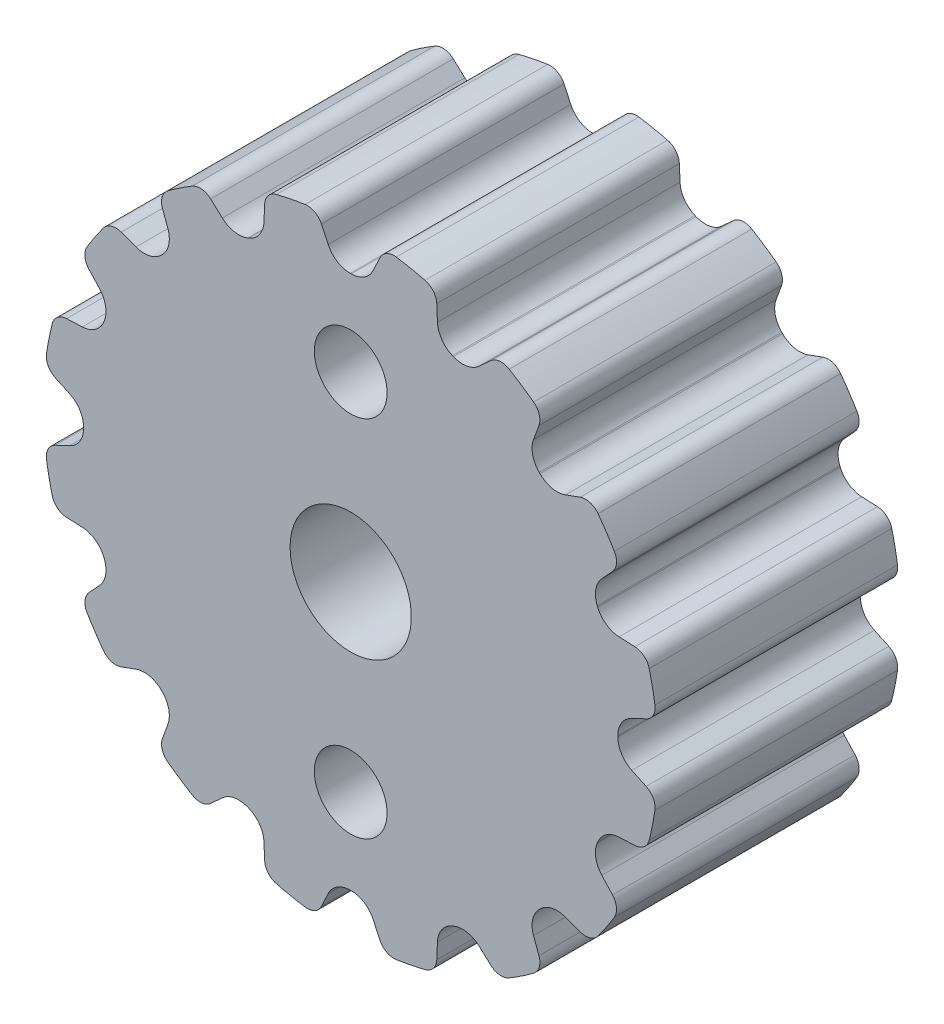
from build123d import *

# Parameters (mm, degrees)
EXTRUDE_2_DEPTH     = 10
SKETCH_2_R          = 1.5
SKETCH_2_R_2        = 2.5
CUT_EXTRUDE_1_DEPTH = 10


with BuildPart() as part:
    # Эскиз1 → Бобышка-Вытянуть2 (new body)
    with BuildSketch(Plane.XY):
        with BuildLine():
            Line((-31.362440493, 3.510393804), (-31.316510754, 3.510393804))
            ThreePointArc((-31.316510754, 3.510393804), (-30.779211146, 3.667002358), (-30.410202967, 4.087775542))
            Line((-30.410202967, 4.087775542), (-30.135127286, 4.677677244))
            ThreePointArc((-30.135127286, 4.677677244), (-29.857903031, 4.971031718), (-29.460241123, 5.040134122))
            ThreePointArc((-29.460241123, 5.040134122), (-28.86569521, 4.936515013), (-28.276753094, 4.804723716))
            ThreePointArc((-28.276753094, 4.804723716), (-27.935805741, 4.588702796), (-27.791945823, 4.211589471))
            Line((-27.791945823, 4.211589471), (-27.763554639, 3.561324458))
            ThreePointArc((-27.763554639, 3.561324458), (-27.583658462, 3.031367409), (-27.14718985, 2.681064313))
            Line((-27.14718985, 2.681064313), (-27.104821217, 2.66351465))
            ThreePointArc((-27.104821217, 2.66351465), (-26.548489607, 2.60258643), (-26.046547577, 2.850116846))
            Line((-26.046547577, 2.850116846), (-25.566665178, 3.289848048))
            ThreePointArc((-25.566665178, 3.289848048), (-25.198281465, 3.454783113), (-24.804445422, 3.366446786))
            ThreePointArc((-24.804445422, 3.366446786), (-24.294809938, 3.043192342), (-23.801132717, 2.696054669))
            ThreePointArc((-23.801132717, 2.696054669), (-23.568806064, 2.366002459), (-23.580211851, 1.96254237))
            Line((-23.580211851, 1.96254237), (-23.802827465, 1.350910998))
            ThreePointArc((-23.802827465, 1.350910998), (-23.839430852, 0.792451241), (-23.570241626, 0.301784073))
            Line((-23.570241626, 0.301784073), (-23.537814077, 0.269356525))
            ThreePointArc((-23.537814077, 0.269356525), (-23.04714691, 0.000167299), (-22.488687153, 0.036770686))
            Line((-22.488687153, 0.036770686), (-21.877055781, 0.259386299))
            ThreePointArc((-21.877055781, 0.259386299), (-21.473595692, 0.270792087), (-21.143543481, 0.038465434))
            ThreePointArc((-21.143543481, 0.038465434), (-20.796405809, -0.455211788), (-20.473151365, -0.964847271))
            ThreePointArc((-20.473151365, -0.964847271), (-20.384815038, -1.358683314), (-20.549750103, -1.727067027))
            Line((-20.549750103, -1.727067027), (-20.989481305, -2.206949426))
            ThreePointArc((-20.989481305, -2.206949426), (-21.237011721, -2.708891456), (-21.176083501, -3.265223066))
            Line((-21.176083501, -3.265223066), (-21.158533838, -3.307591699))
            ThreePointArc((-21.158533838, -3.307591699), (-20.808230742, -3.744060311), (-20.278273693, -3.923956489))
            Line((-20.278273693, -3.923956489), (-19.628008679, -3.952347672))
            ThreePointArc((-19.628008679, -3.952347672), (-19.250895355, -4.09620759), (-19.034874434, -4.437154943))
            ThreePointArc((-19.034874434, -4.437154943), (-18.903083138, -5.026097059), (-18.799464029, -5.620642972))
            ThreePointArc((-18.799464029, -5.620642972), (-18.868566433, -6.01830488), (-19.161920907, -6.295529135))
            Line((-19.161920907, -6.295529135), (-19.751822608, -6.570604816))
            ThreePointArc((-19.751822608, -6.570604816), (-20.172595793, -6.939612995), (-20.329204347, -7.476912603))
            Line((-20.329204347, -7.476912603), (-20.329204347, -7.522772082))
            ThreePointArc((-20.329204347, -7.522772082), (-20.172595793, -8.06007169), (-19.751822608, -8.429079869))
            Line((-19.751822608, -8.429079869), (-19.161920907, -8.704155549))
            ThreePointArc((-19.161920907, -8.704155549), (-18.868566433, -8.981379805), (-18.799464029, -9.379041713))
            ThreePointArc((-18.799464029, -9.379041713), (-18.903083138, -9.973587626), (-19.034874434, -10.562529742))
            ThreePointArc((-19.034874434, -10.562529742), (-19.250895355, -10.903477094), (-19.628008679, -11.047337012))
            Line((-19.628008679, -11.047337012), (-20.278273693, -11.075728196))
            ThreePointArc((-20.278273693, -11.075728196), (-20.808230742, -11.255624373), (-21.158533838, -11.692092985))
            Line((-21.158533838, -11.692092985), (-21.176083501, -11.734461619))
            ThreePointArc((-21.176083501, -11.734461619), (-21.237011721, -12.290793229), (-20.989481305, -12.792735259))
            Line((-20.989481305, -12.792735259), (-20.549750103, -13.272617658))
            ThreePointArc((-20.549750103, -13.272617658), (-20.384815038, -13.64100137), (-20.473151365, -14.034837413))
            ThreePointArc((-20.473151365, -14.034837413), (-20.796405809, -14.544472897), (-21.143543481, -15.038150118))
            ThreePointArc((-21.143543481, -15.038150118), (-21.473595692, -15.270476771), (-21.877055781, -15.259070984))
            Line((-21.877055781, -15.259070984), (-22.488687153, -15.03645537))
            ThreePointArc((-22.488687153, -15.03645537), (-23.04714691, -14.999851984), (-23.537814077, -15.26904121))
            Line((-23.537814077, -15.26904121), (-23.570241626, -15.301468758))
            ThreePointArc((-23.570241626, -15.301468758), (-23.839430852, -15.792135925), (-23.802827465, -16.350595683))
            Line((-23.802827465, -16.350595683), (-23.580211851, -16.962227055))
            ThreePointArc((-23.580211851, -16.962227055), (-23.568806064, -17.365687144), (-23.801132717, -17.695739354))
            ThreePointArc((-23.801132717, -17.695739354), (-24.294809938, -18.042877026), (-24.804445422, -18.366131471))
            ThreePointArc((-24.804445422, -18.366131471), (-25.198281465, -18.454467798), (-25.566665178, -18.289532733))
            Line((-25.566665178, -18.289532733), (-26.046547577, -17.849801531))
            ThreePointArc((-26.046547577, -17.849801531), (-26.548489607, -17.602271114), (-27.104821217, -17.663199335))
            Line((-27.104821217, -17.663199335), (-27.14718985, -17.680748997))
            ThreePointArc((-27.14718985, -17.680748997), (-27.583658462, -18.031052094), (-27.763554639, -18.561009143))
            Line((-27.763554639, -18.561009143), (-27.791945823, -19.211274156))
            ThreePointArc((-27.791945823, -19.211274156), (-27.935805741, -19.58838748), (-28.276753094, -19.804408401))
            ThreePointArc((-28.276753094, -19.804408401), (-28.86569521, -19.936199698), (-29.460241123, -20.039818807))
            ThreePointArc((-29.460241123, -20.039818807), (-29.857903031, -19.970716403), (-30.135127286, -19.677361928))
            Line((-30.135127286, -19.677361928), (-30.410202967, -19.087460227))
            ThreePointArc((-30.410202967, -19.087460227), (-30.779211146, -18.666687043), (-31.316510754, -18.510078489))
            Line((-31.316510754, -18.510078489), (-31.362370232, -18.510078489))
            ThreePointArc((-31.362370232, -18.510078489), (-31.899669841, -18.666687043), (-32.268678019, -19.087460227))
            Line((-32.268678019, -19.087460227), (-32.5437537, -19.677361928))
            ThreePointArc((-32.5437537, -19.677361928), (-32.820977955, -19.970716403), (-33.218639863, -20.039818807))
            ThreePointArc((-33.218639863, -20.039818807), (-33.813185776, -19.936199698), (-34.402127893, -19.804408401))
            ThreePointArc((-34.402127893, -19.804408401), (-34.743075245, -19.58838748), (-34.886935163, -19.211274156))
            Line((-34.886935163, -19.211274156), (-34.915326347, -18.561009143))
            ThreePointArc((-34.915326347, -18.561009143), (-35.095222524, -18.031052094), (-35.531691136, -17.680748997))
            Line((-35.531691136, -17.680748997), (-35.57405977, -17.663199335))
            ThreePointArc((-35.57405977, -17.663199335), (-36.13039138, -17.602271114), (-36.632333409, -17.849801531))
            Line((-36.632333409, -17.849801531), (-37.112215809, -18.289532733))
            ThreePointArc((-37.112215809, -18.289532733), (-37.480599521, -18.454467798), (-37.874435564, -18.366131471))
            ThreePointArc((-37.874435564, -18.366131471), (-38.384071048, -18.042877026), (-38.877748269, -17.695739354))
            ThreePointArc((-38.877748269, -17.695739354), (-39.110074922, -17.365687144), (-39.098669135, -16.962227055))
            Line((-39.098669135, -16.962227055), (-38.876053521, -16.350595683))
            ThreePointArc((-38.876053521, -16.350595683), (-38.839450135, -15.792135925), (-39.108639361, -15.301468758))
            Line((-39.108639361, -15.301468758), (-39.141066909, -15.26904121))
            ThreePointArc((-39.141066909, -15.26904121), (-39.631734076, -14.999851984), (-40.190193833, -15.03645537))
            Line((-40.190193833, -15.03645537), (-40.801825206, -15.259070984))
            ThreePointArc((-40.801825206, -15.259070984), (-41.205285295, -15.270476771), (-41.535337505, -15.038150118))
            ThreePointArc((-41.535337505, -15.038150118), (-41.882475177, -14.544472897), (-42.205729622, -14.034837413))
            ThreePointArc((-42.205729622, -14.034837413), (-42.294065949, -13.64100137), (-42.129130884, -13.272617658))
            Line((-42.129130884, -13.272617658), (-41.689399681, -12.792735259))
            ThreePointArc((-41.689399681, -12.792735259), (-41.441869265, -12.290793229), (-41.502797486, -11.734461619))
            Line((-41.502797486, -11.734461619), (-41.520347148, -11.692092985))
            ThreePointArc((-41.520347148, -11.692092985), (-41.870650244, -11.255624373), (-42.400607293, -11.075728196))
            Line((-42.400607293, -11.075728196), (-43.050872307, -11.047337012))
            ThreePointArc((-43.050872307, -11.047337012), (-43.427985631, -10.903477094), (-43.644006552, -10.562529742))
            ThreePointArc((-43.644006552, -10.562529742), (-43.775797849, -9.973587626), (-43.879416957, -9.379041713))
            ThreePointArc((-43.879416957, -9.379041713), (-43.810314553, -8.981379805), (-43.516960079, -8.704155549))
            Line((-43.516960079, -8.704155549), (-42.927058378, -8.429079869))
            ThreePointArc((-42.927058378, -8.429079869), (-42.506285194, -8.06007169), (-42.34967664, -7.522772082))
            Line((-42.34967664, -7.522772082), (-42.34967664, -7.476912603))
            ThreePointArc((-42.34967664, -7.476912603), (-42.506285194, -6.939612995), (-42.927058378, -6.570604816))
            Line((-42.927058378, -6.570604816), (-43.516960079, -6.295529135))
            ThreePointArc((-43.516960079, -6.295529135), (-43.810314553, -6.01830488), (-43.879416957, -5.620642972))
            ThreePointArc((-43.879416957, -5.620642972), (-43.775797849, -5.026097059), (-43.644006552, -4.437154943))
            ThreePointArc((-43.644006552, -4.437154943), (-43.427985631, -4.09620759), (-43.050872307, -3.952347672))
            Line((-43.050872307, -3.952347672), (-42.400607293, -3.923956489))
            ThreePointArc((-42.400607293, -3.923956489), (-41.870650244, -3.744060311), (-41.520347148, -3.307591699))
            Line((-41.520347148, -3.307591699), (-41.502797486, -3.265223066))
            ThreePointArc((-41.502797486, -3.265223066), (-41.441869265, -2.708891456), (-41.689399681, -2.206949426))
            Line((-41.689399681, -2.206949426), (-42.129130884, -1.727067027))
            ThreePointArc((-42.129130884, -1.727067027), (-42.294065949, -1.358683314), (-42.205729622, -0.964847271))
            ThreePointArc((-42.205729622, -0.964847271), (-41.882475177, -0.455211788), (-41.535337505, 0.038465434))
            ThreePointArc((-41.535337505, 0.038465434), (-41.205285295, 0.270792087), (-40.801825206, 0.259386299))
            Line((-40.801825206, 0.259386299), (-40.190193833, 0.036770686))
            ThreePointArc((-40.190193833, 0.036770686), (-39.631734076, 0.000167299), (-39.141066909, 0.269356525))
            Line((-39.141066909, 0.269356525), (-39.108639361, 0.301784073))
            ThreePointArc((-39.108639361, 0.301784073), (-38.839450135, 0.792451241), (-38.876053521, 1.350910998))
            Line((-38.876053521, 1.350910998), (-39.098669135, 1.96254237))
            ThreePointArc((-39.098669135, 1.96254237), (-39.110074922, 2.366002459), (-38.877748269, 2.696054669))
            ThreePointArc((-38.877748269, 2.696054669), (-38.384071048, 3.043192342), (-37.874435564, 3.366446786))
            ThreePointArc((-37.874435564, 3.366446786), (-37.480599521, 3.454783113), (-37.112215809, 3.289848048))
            Line((-37.112215809, 3.289848048), (-36.632333409, 2.850116846))
            ThreePointArc((-36.632333409, 2.850116846), (-36.13039138, 2.60258643), (-35.57405977, 2.66351465))
            Line((-35.57405977, 2.66351465), (-35.531691136, 2.681064313))
            ThreePointArc((-35.531691136, 2.681064313), (-35.095222524, 3.031367409), (-34.915326347, 3.561324458))
            Line((-34.915326347, 3.561324458), (-34.886935163, 4.211589471))
            ThreePointArc((-34.886935163, 4.211589471), (-34.743075245, 4.588702796), (-34.402127893, 4.804723716))
            ThreePointArc((-34.402127893, 4.804723716), (-33.813220072, 4.936508191), (-33.218709026, 5.040123757))
            ThreePointArc((-33.218709026, 5.040123757), (-32.821045182, 4.971022711), (-32.543819372, 4.677667402))
            Line((-32.543819372, 4.677667402), (-32.26874828, 4.087775542))
            ThreePointArc((-32.26874828, 4.087775542), (-31.899740101, 3.667002358), (-31.362440493, 3.510393804))
        make_face()
    extrude(amount=EXTRUDE_2_DEPTH)

    # Эскиз2 → Вырез-Вытянуть1 (cut)
    with BuildSketch(Plane(origin=(0, 0, 0), x_dir=(-1, 0, 0), z_dir=(0, 0, -1))):
        with Locations((31.339440493, 0.000157658)):
            Circle(SKETCH_2_R)
        with Locations((31.339440493, -14.999842342)):
            Circle(SKETCH_2_R)
        with Locations((31.339440493, -7.499842342)):
            Circle(SKETCH_2_R_2)
    extrude(amount=-CUT_EXTRUDE_1_DEPTH, mode=Mode.SUBTRACT)


solid = part.part
